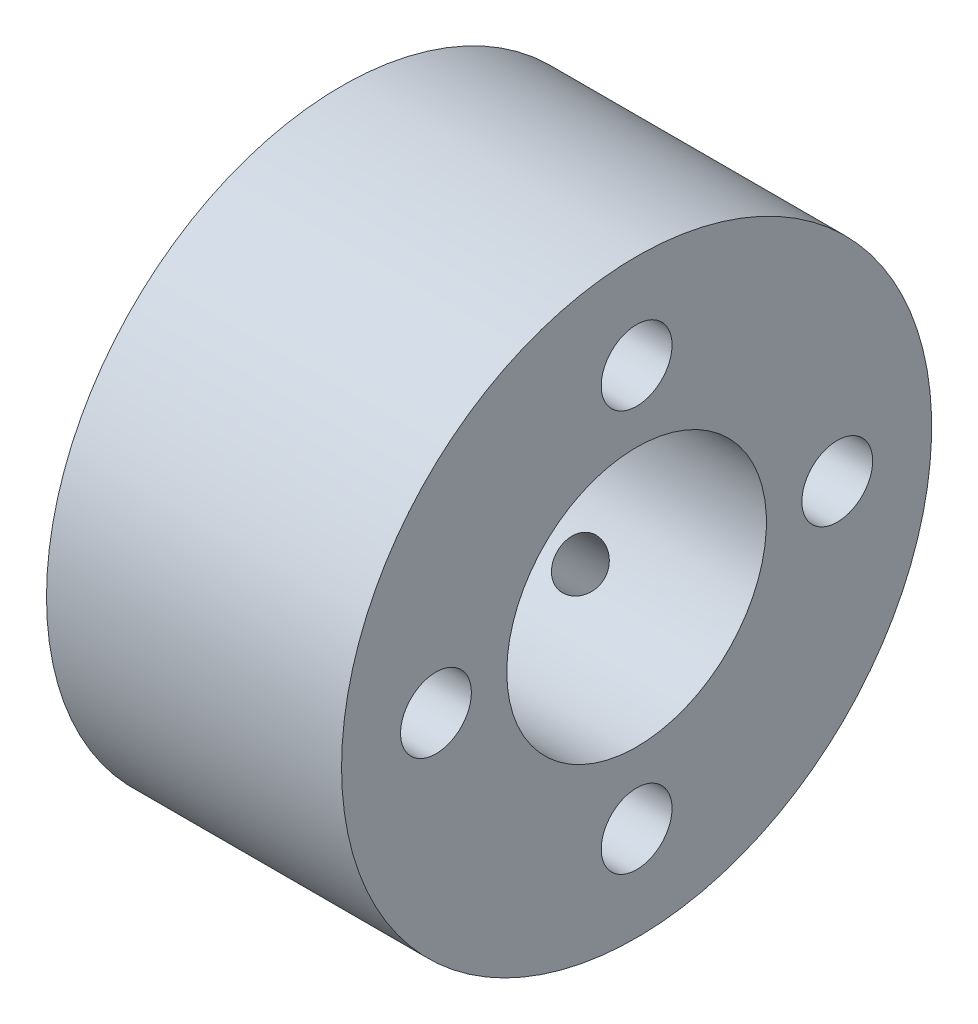
from build123d import *

# Parameters (mm, degrees)
SKETCH1_W                  = 25
SKETCH1_H                  = 14
F_6_0MM_DOWEL_HOLE1_D      = 6
CIRPATTERN1_COUNT          = 4
F_4_0MM_DOWEL_HOLE1_REACH  = 63.636
F_4_0MM_DOWEL_HOLE1_BORE_R = 2


with BuildPart() as part:
    # Sketch1 → Revolve2 (revolve)
    with BuildSketch(Plane(origin=(0, 0, 0), x_dir=(1, 0, 0), z_dir=(0, 1, 0)), mode=Mode.PRIVATE) as revolve2_sk:
        with Locations((0, 18)):
            Rectangle(SKETCH1_W, SKETCH1_H)
    revolve(revolve2_sk.sketch.rotate(Axis((-25.731009954, 0, 0), (1, 0, 0)), 180), axis=Axis((-25.731009954, 0, 0), (1, 0, 0)))

    # Ø6.0mm Dowel Hole1 (through all)
    with Locations(Plane(origin=(12.5, 0, 0), x_dir=(0, 0, -1), z_dir=(1, 0, 0))):
        with Locations((0, 17)):
            f_6_0mm_dowel_hole1 = Hole(F_6_0MM_DOWEL_HOLE1_D / 2)

    # CirPattern1: Ø6.0mm Dowel Hole1 ×4 about axis
    cirpattern1_axis = Axis((0, 0, 0), (1, 0, 0))
    for i in range(1, CIRPATTERN1_COUNT):
        add(f_6_0mm_dowel_hole1.rotate(cirpattern1_axis, i * 360 / CIRPATTERN1_COUNT), mode=Mode.SUBTRACT)

    # Ø4.0mm Dowel Hole1 bore (on position points) → Ø4.0mm Dowel Hole1 (cut, up to next)
    with BuildSketch(Plane(origin=(0, -17.677561289, -17.67777777), x_dir=(0, -0.7071111108, 0.707102451547), z_dir=(0, -0.707102451547, -0.7071111108)), mode=Mode.PRIVATE) as f_4_0mm_dowel_hole1_sk1:
        Circle(F_4_0MM_DOWEL_HOLE1_BORE_R)
    f_4_0mm_dowel_hole1_tool1 = extrude(f_4_0mm_dowel_hole1_sk1.sketch, amount=-F_4_0MM_DOWEL_HOLE1_REACH, mode=Mode.PRIVATE) & part.part
    add(f_4_0mm_dowel_hole1_tool1.solids().sort_by_distance((0, -17.677561, -17.677778))[0], mode=Mode.SUBTRACT)


solid = part.part
